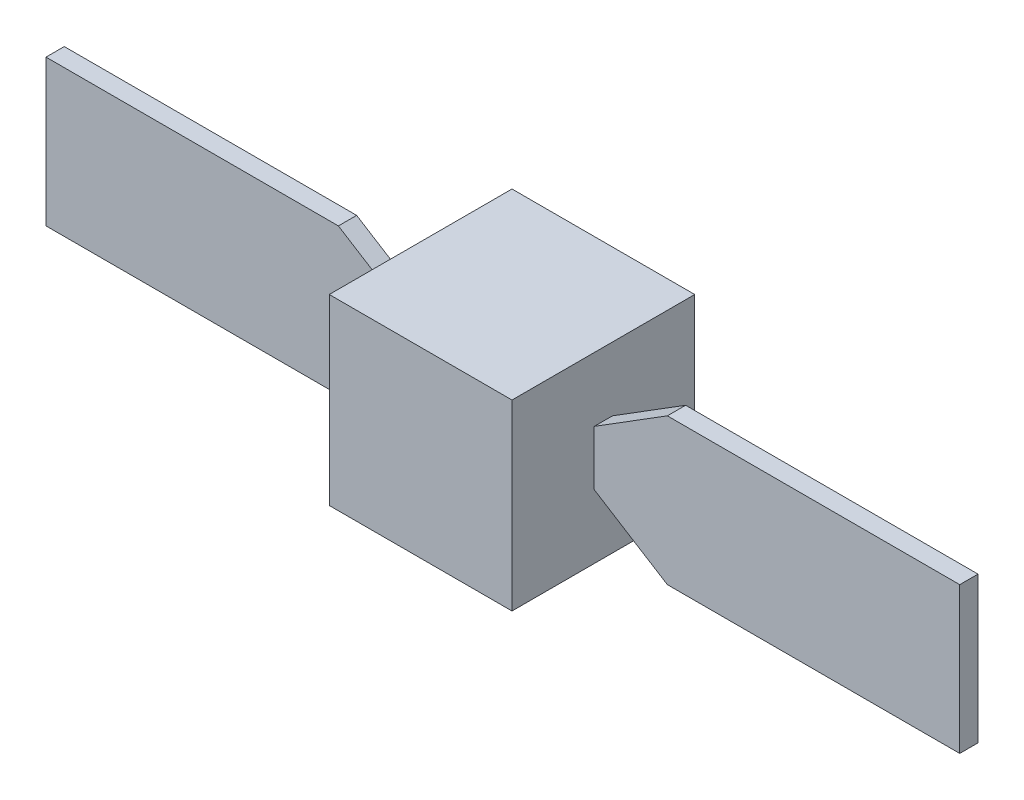
from build123d import *

# Parameters (mm, degrees)
EXTRUDE_1_DEPTH = 50
EXTRUDE_2_DEPTH = 5


with BuildPart() as part:
    # 草图1 → 凸台-拉伸1 (new, symmetric)
    with BuildSketch(Plane.XY):
        Polygon((-50, -15), (-50, -50), (50, -50), (50, -15), (50, 15), (50, 50), (-50, 50), (-50, 15), align=None)
    extrude(amount=EXTRUDE_1_DEPTH, both=True)

    # 草图1<3> → 凸台-拉伸2 (add, symmetric)
    with BuildSketch(Plane.XY):
        Polygon((-90.014973854, -40), (-50, -15), (-50, 15), (-90, 40), (-250, 40), (-250, -40), align=None)
        Polygon((50, 15), (50, -15), (90, -40), (250, -40), (250, 40), (90, 40), align=None)
    extrude(amount=EXTRUDE_2_DEPTH, both=True)


solid = part.part
